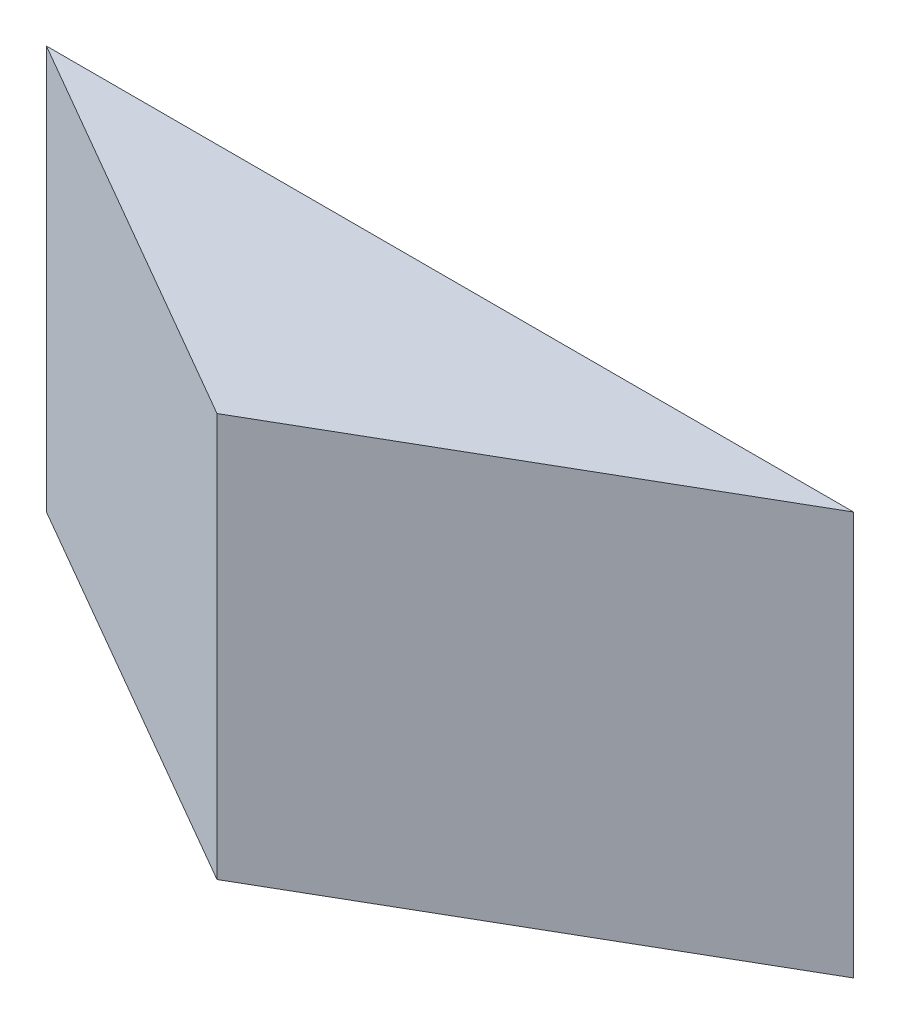
from build123d import *

# Parameters (mm, degrees)
BOSS_EXTRUDE1_DEPTH = 20


with BuildPart() as part:
    # Sketch1 → Boss-Extrude1 (new body)
    with BuildSketch(Plane(origin=(0, 0, 0), x_dir=(1, 0, 0), z_dir=(0, 1, 0))):
        Polygon((-20, 0), (20, 0), (0, -11.547005384), align=None)
    extrude(amount=BOSS_EXTRUDE1_DEPTH)


solid = part.part
